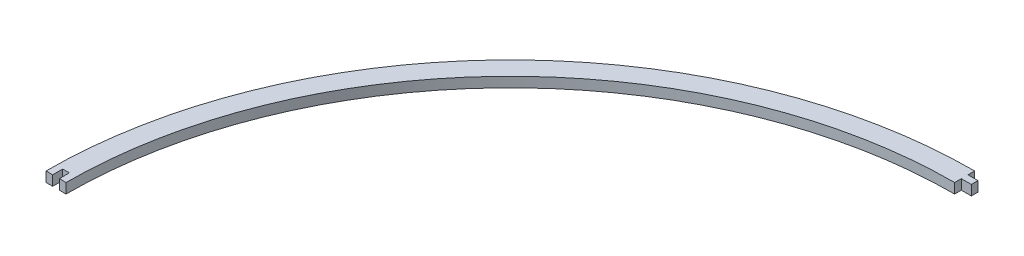
from build123d import *

# Parameters (mm, degrees)
BOSS_EXTRUDE1_DEPTH = 6.35


with BuildPart() as part:
    # Sketch1 → Boss-Extrude1 (new body)
    with BuildSketch(Plane(origin=(0, 0, 0), x_dir=(1, 0, 0), z_dir=(0, 1, 0))):
        with BuildLine():
            Line((0, 294.386), (0, 290.152666667))
            Line((0, 290.152666667), (6.35, 290.152666667))
            Line((6.35, 290.152666667), (6.35, 285.919333333))
            Line((6.35, 285.919333333), (0, 285.919333333))
            Line((0, 285.919333333), (0, 281.686))
            ThreePointArc((0, 281.686), (-199.182080765, 199.182080765), (-281.686, 0))
            Line((-281.686, 0), (-285.919333333, 0))
            Line((-285.919333333, 0), (-285.919333333, 6.35))
            Line((-285.919333333, 6.35), (-290.152666667, 6.35))
            Line((-290.152666667, 6.35), (-290.152666667, 0))
            Line((-290.152666667, 0), (-294.386, 0))
            ThreePointArc((-294.386, 0), (-208.162336886, 208.162336886), (0, 294.386))
        make_face()
    extrude(amount=BOSS_EXTRUDE1_DEPTH)


solid = part.part
